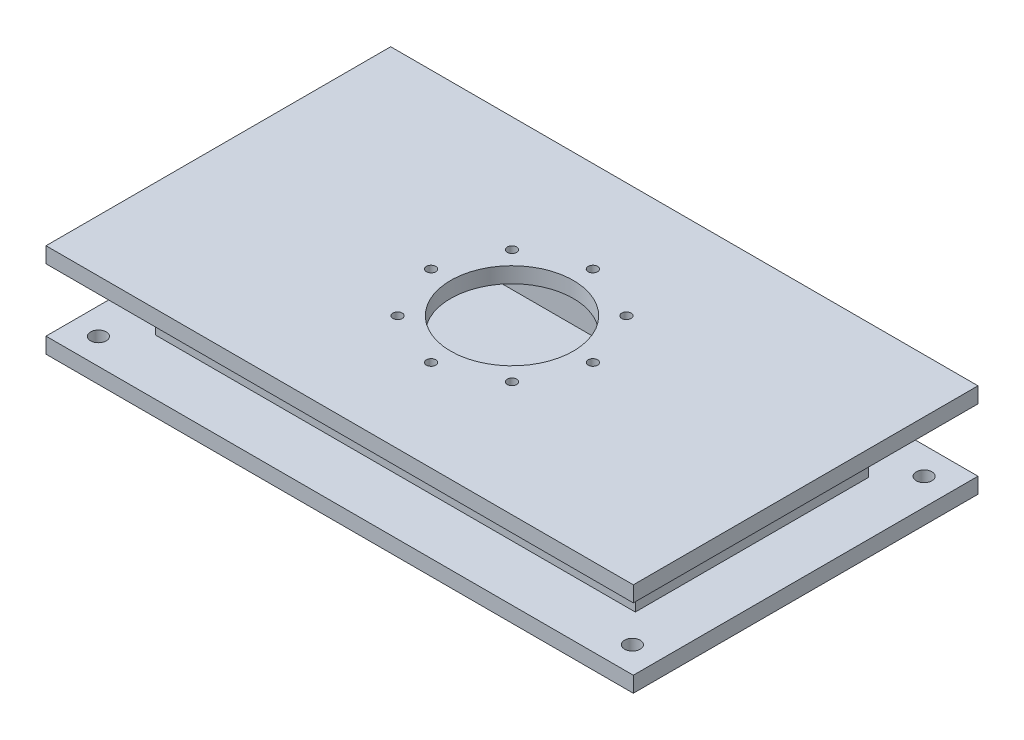
from build123d import *

# Parameters (mm, degrees)
SKETCH1_W           = 112.522
SKETCH1_H           = 66.04
SKETCH1_R           = 1.5
BOSS_EXTRUDE1_DEPTH = 3
SKETCH4_W           = 91.948
SKETCH4_H           = 44.704
BOSS_EXTRUDE2_DEPTH = 12
SHELL1_T            = -2.54
SKETCH13_R          = 3.253406585
CUT_EXTRUDE1_DEPTH  = 8.19
SKETCH15_R          = 3.393829234
CUT_EXTRUDE2_DEPTH  = 8.19
SKETCH16_W          = 112.522
SKETCH16_H          = 66.04
SKETCH16_R          = 11.75
SKETCH16_R_2        = 0.902882747
BOSS_EXTRUDE4_DEPTH = 3


with BuildPart() as part:
    # Sketch1 → Boss-Extrude1 (new body)
    with BuildSketch(Plane(origin=(0, 0, 0), x_dir=(1, 0, 0), z_dir=(0, 1, 0))):
        with Locations((4.991983213, -7.115654676)):
            Rectangle(SKETCH1_W, SKETCH1_H)
        with Locations(Location((-46.207741765, 20.726518927, 0), (0, 0, 270))):
            Circle(SKETCH1_R, mode=Mode.SUBTRACT)
        with Locations(Location((56.100367261, 20.726518927, 0), (0, 0, 270))):
            Circle(SKETCH1_R, mode=Mode.SUBTRACT)
        with Locations(Location((56.100367261, -35.155923699, 0), (0, 0, 270))):
            Circle(SKETCH1_R, mode=Mode.SUBTRACT)
        with Locations(Location((-46.207741765, -35.155923699, 0), (0, 0, 270))):
            Circle(SKETCH1_R, mode=Mode.SUBTRACT)
    extrude(amount=BOSS_EXTRUDE1_DEPTH)

    # Sketch4 → Boss-Extrude2 (add)
    with BuildSketch(Plane(origin=(0, 3, 0), x_dir=(1, 0, 0), z_dir=(0, 1, 0))):
        with Locations((4.991983213, -7.115654676)):
            Rectangle(SKETCH4_W, SKETCH4_H)
    extrude(amount=BOSS_EXTRUDE2_DEPTH)

    # Shell1
    shell1_openings = [part.faces().sort_by_distance(p)[0] for p in [
        (4.991983213, 15, 7.115654676),
    ]]
    offset(amount=SHELL1_T, openings=shell1_openings, kind=Kind.INTERSECTION)

    # Sketch13 → Cut-Extrude1 (cut)
    with BuildSketch(Plane.XY.offset(29.467654676)):
        with Locations((-28.892784248, 9.118527178)):
            Circle(SKETCH13_R)
    extrude(amount=-CUT_EXTRUDE1_DEPTH, mode=Mode.SUBTRACT)

    # Sketch15 → Cut-Extrude2 (cut)
    with BuildSketch(Plane.ZY.offset(40.982016787)):
        with Locations((-6.693412029, 8.197427611)):
            Circle(SKETCH15_R)
    extrude(amount=-CUT_EXTRUDE2_DEPTH, mode=Mode.SUBTRACT)

    # Sketch16 → Boss-Extrude4 (add)
    with BuildSketch(Plane(origin=(0, 15, 0), x_dir=(1, 0, 0), z_dir=(0, 1, 0))):
        with Locations((4.991983213, -7.115654676)):
            Rectangle(SKETCH16_W, SKETCH16_H)
        with Locations(Location((4.991983213, -7.115654676, 0), (0, 0, 270))):
            Circle(SKETCH16_R, mode=Mode.SUBTRACT)
        with Locations(Location((4.991983213, 8.384345324, 0), (0, 0, 270))):
            Circle(SKETCH16_R_2, mode=Mode.SUBTRACT)
        with Locations(Location((-5.968171895, 3.844500432, 0), (0, 0, 270))):
            Circle(SKETCH16_R_2, mode=Mode.SUBTRACT)
        with Locations(Location((-10.508016787, -7.115654676, 0), (0, 0, 270))):
            Circle(SKETCH16_R_2, mode=Mode.SUBTRACT)
        with Locations(Location((-5.968171895, -18.075809785, 0), (0, 0, 270))):
            Circle(SKETCH16_R_2, mode=Mode.SUBTRACT)
        with Locations(Location((4.991983213, -22.615654676, 0), (0, 0, 270))):
            Circle(SKETCH16_R_2, mode=Mode.SUBTRACT)
        with Locations(Location((15.952138322, -18.075809785, 0), (0, 0, 270))):
            Circle(SKETCH16_R_2, mode=Mode.SUBTRACT)
        with Locations(Location((20.491983213, -7.115654676, 0), (0, 0, 270))):
            Circle(SKETCH16_R_2, mode=Mode.SUBTRACT)
        with Locations(Location((15.952138322, 3.844500432, 0), (0, 0, 270))):
            Circle(SKETCH16_R_2, mode=Mode.SUBTRACT)
    extrude(amount=BOSS_EXTRUDE4_DEPTH)


solid = part.part
